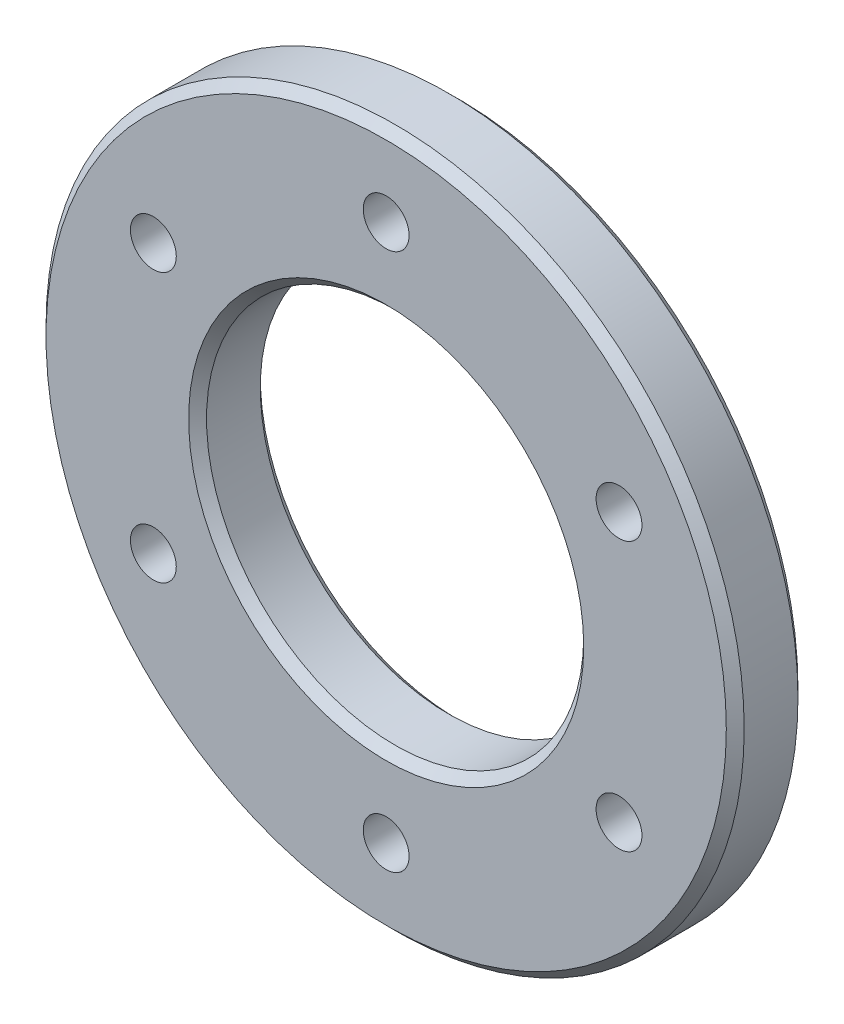
from build123d import *

# Parameters (mm, degrees)
SKETCH1_R           = 30.9372
SKETCH1_R_2         = 2.032
SKETCH1_R_3         = 16.7132
BOSS_EXTRUDE1_DEPTH = 6.35
CHAMFER1_SIZE       = 0.79375


with BuildPart() as part:
    # Sketch1 → Boss-Extrude1 (new body)
    with BuildSketch(Plane.XY):
        Circle(SKETCH1_R)
        with Locations((0, 23.8252)):
            Circle(SKETCH1_R_2, mode=Mode.SUBTRACT)
        Circle(SKETCH1_R_3, mode=Mode.SUBTRACT)
        with Locations((20.63322845, 11.9126)):
            Circle(SKETCH1_R_2, mode=Mode.SUBTRACT)
        with Locations((20.63322845, -11.9126)):
            Circle(SKETCH1_R_2, mode=Mode.SUBTRACT)
        with Locations((0, -23.8252)):
            Circle(SKETCH1_R_2, mode=Mode.SUBTRACT)
        with Locations((-20.63322845, -11.9126)):
            Circle(SKETCH1_R_2, mode=Mode.SUBTRACT)
        with Locations((-20.63322845, 11.9126)):
            Circle(SKETCH1_R_2, mode=Mode.SUBTRACT)
    extrude(amount=BOSS_EXTRUDE1_DEPTH)

    # Chamfer1
    chamfer1_edges = [part.edges().sort_by_distance(p)[0] for p in [
        (-30.9372, 0, 0),
        (-30.9372, 0, 6.35),
        (-16.7132, 0, 0),
        (-16.7132, 0, 6.35),
    ]]
    chamfer(chamfer1_edges, length=CHAMFER1_SIZE)


solid = part.part
